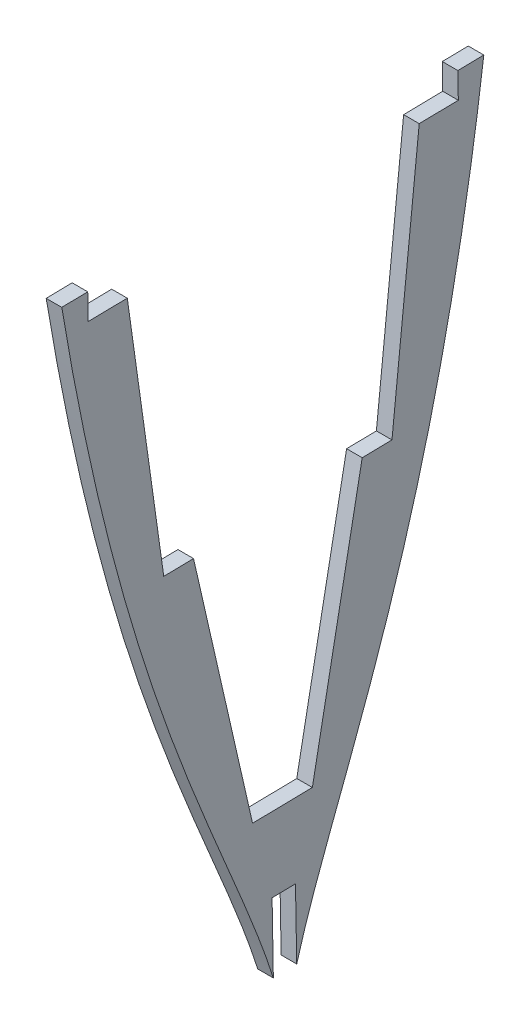
from build123d import *

# Parameters (mm, degrees)
BOSS_EXTRU_3_DEPTH      = 6
ENL_V_MAT_EXTRU_1_DEPTH = 6


with BuildPart() as part:
    # Esquisse2 → Boss.-Extru.3 (new body)
    with BuildSketch(Plane(origin=(0, 0, 0), x_dir=(0, 0, -1), z_dir=(1, 0, 0))):
        with BuildLine():
            Line((74.618325874, 374.992738115), (64.619898014, 374.815423904))
            Line((64.619898014, 374.815423904), (64.797240105, 364.815423904))
            Line((64.797240105, 364.815423904), (49.744886259, 364.548482314))
            Line((49.744886259, 364.548482314), (39.25351054, 264.34670219))
            Line((39.25351054, 264.34670219), (27.791840205, 264.143438531))
            Line((27.791840205, 264.143438531), (8.608679942, 163.787516483))
            Line((8.608679942, 163.787516483), (-14.410724428, 163.379285552))
            Line((-14.410724428, 163.379285552), (-37.140168903, 262.991920703))
            Line((-37.140168903, 262.991920703), (-48.601839238, 262.788657044))
            Line((-48.601839238, 262.788657044), (-62.63949917, 362.55543412))
            Line((-62.63949917, 362.55543412), (-77.691853016, 362.288492529))
            Line((-77.691853016, 362.288492529), (-77.869195107, 372.288492529))
            Line((-77.869195107, 372.288492529), (-87.867622967, 372.111178318))
            add(Edge.make_bspline(
                [(-87.867622967, 372.111178318), (-59.516280682, 201.635856835), (-13.877681777, 148.355356273), (-1.589058887, 89.604158615)],
                knots=[0, 0, 0, 0, 1, 1, 1, 1], degree=3))
            add(Edge.make_bspline(
                [(74.618325874, 374.992738115), (52.329400068, 203.619351527), (8.608679942, 148.754134114), (-1.589058887, 89.604158615)],
                knots=[0, 0, 0, 0, 1, 1, 1, 1], degree=3))
        make_face()
    extrude(amount=BOSS_EXTRU_3_DEPTH)

    # Esquisse3 → Enlèv. mat.-Extru.1 (cut)
    with BuildSketch(Plane(origin=(6, 0, 0), x_dir=(0, 0, -1), z_dir=(1, 0, 0))):
        Polygon((-6.412113806, 107.780742732), (-6.890862174, 134.776497954), (2.1077229, 134.936080743), (2.586471268, 107.940325521), (34.327571805, 86.65842575), (-33.704659322, 86.65842575), align=None)
    extrude(amount=-ENL_V_MAT_EXTRU_1_DEPTH, mode=Mode.SUBTRACT)


solid = part.part
